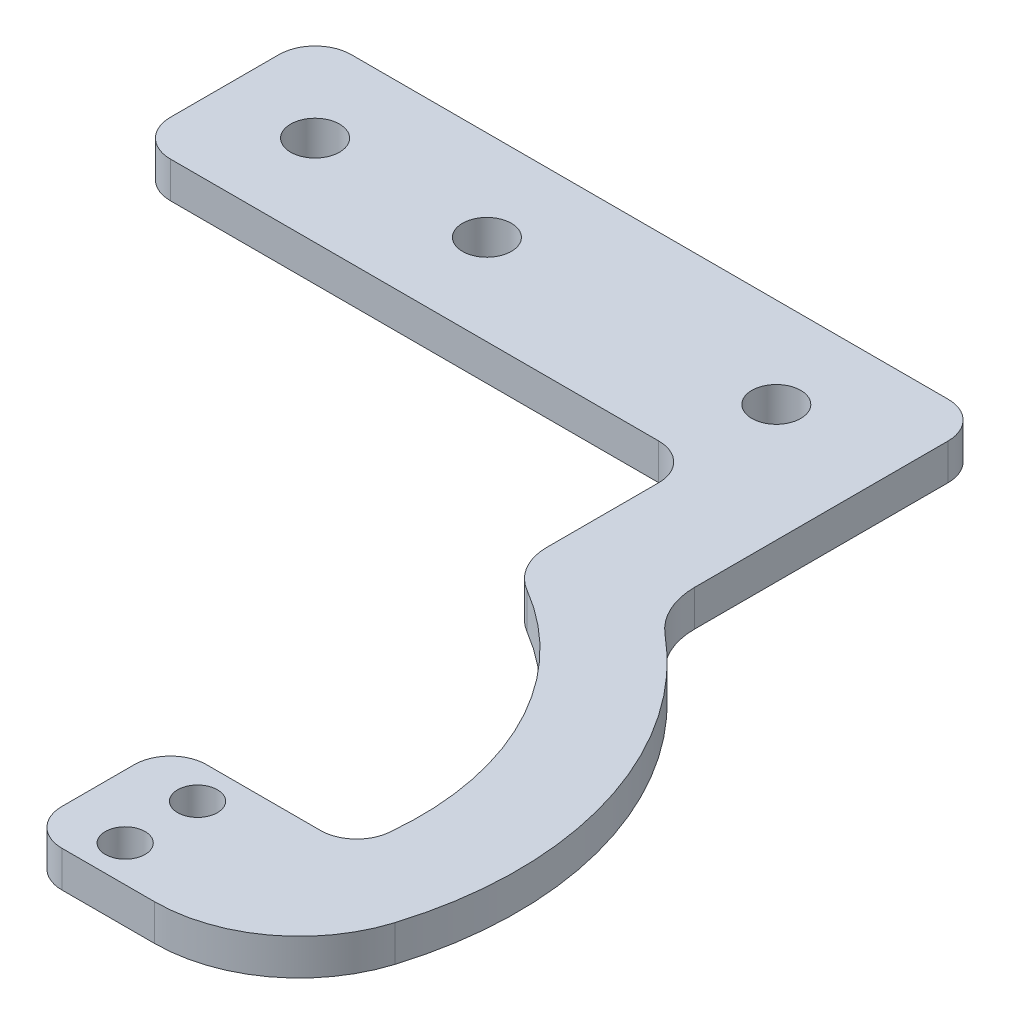
from build123d import *
from OCP.BRepFilletAPI import BRepFilletAPI_MakeFillet

# Parameters (mm, degrees)
SKETCH_1_R      = 1.35
EXTRUDE_1_DEPTH = 2
SKETCH_2_R      = 1.1
EXTRUDE_2_DEPTH = 2
FILLET_3_R1     = 3
FILLET_3_R2     = 4
FILLET_3_R3     = 2
FILLET_3_R4     = 8
FILLET_4_R      = 2


with BuildPart() as part:
    # 草图1 → 凸台-拉伸1 (new body)
    with BuildSketch(Plane(origin=(0, 0, 0), x_dir=(1, 0, 0), z_dir=(0, 1, 0))):
        Polygon((-13.5, -5), (13.5, -5), (13.5, 5), (-13.5, 5), (-23.5, 5), (-23.5, -5), align=None)
        with Locations(Location((7, 0, 0), (0, 0, 270))):
            Circle(SKETCH_1_R, mode=Mode.SUBTRACT)
        with Locations(Location((-9, 0, 0), (0, 0, 90))):
            Circle(SKETCH_1_R, mode=Mode.SUBTRACT)
        with Locations(Location((-18.5, 0, 0), (0, 0, 270))):
            Circle(SKETCH_1_R, mode=Mode.SUBTRACT)
    extrude(amount=EXTRUDE_1_DEPTH)

    # 草图2 → 凸台-拉伸2 (add)
    with BuildSketch(Plane(origin=(0, 2, 0), x_dir=(1, 0, 0), z_dir=(0, 1, 0))):
        with BuildLine():
            Line((13.5, -5), (13.5, -13))
            ThreePointArc((13.5, -13), (21.845175456, -25.956218669), (18.5, -41))
            Line((18.5, -41), (6.5, -41))
            Line((6.5, -41), (6.5, -33))
            Line((6.5, -33), (16.5, -33))
            ThreePointArc((16.5, -33), (15.184290219, -22.40785489), (7.5, -15))
            Line((7.5, -15), (7.5, -5))
            Line((7.5, -5), (13.5, -5))
        make_face()
        with Locations(Location((10, -39, 0), (0, 0, 270))):
            Circle(SKETCH_2_R, mode=Mode.SUBTRACT)
        with Locations(Location((10, -35, 0), (0, 0, 90))):
            Circle(SKETCH_2_R, mode=Mode.SUBTRACT)
    extrude(amount=-EXTRUDE_2_DEPTH)

    # 圆角3: one fillet with a radius per group of edges: ONE call of the kernel's fillet builder (fillet() takes one radius for all edges)
    fillet_3_edges_1 = [part.edges().sort_by_distance(p)[0] for p in [
        (7.5, 1, 15),
    ]]
    fillet_3_edges_2 = [part.edges().sort_by_distance(p)[0] for p in [
        (13.5, 1, 13),
    ]]
    fillet_3_edges_3 = [part.edges().sort_by_distance(p)[0] for p in [
        (16.5, 1, 33),
    ]]
    fillet_3_edges_4 = [part.edges().sort_by_distance(p)[0] for p in [
        (18.5, 1, 41),
    ]]
    fillet_3 = BRepFilletAPI_MakeFillet(part.part.solid().wrapped)
    for e in fillet_3_edges_1:
        fillet_3.Add(FILLET_3_R1, e.wrapped)
    for e in fillet_3_edges_2:
        fillet_3.Add(FILLET_3_R2, e.wrapped)
    for e in fillet_3_edges_3:
        fillet_3.Add(FILLET_3_R3, e.wrapped)
    for e in fillet_3_edges_4:
        fillet_3.Add(FILLET_3_R4, e.wrapped)
    add(Compound.cast(fillet_3.Shape()), mode=Mode.REPLACE)

    # 圆角4
    fillet_4_edges = [part.edges().sort_by_distance(p)[0] for p in [
        (-23.5, 1, 5),
        (-23.5, 1, -5),
        (13.5, 1, -5),
        (7.5, 1, 5),
        (6.5, 1, 41),
        (6.5, 1, 33),
    ]]
    fillet(fillet_4_edges, radius=FILLET_4_R)


solid = part.part
